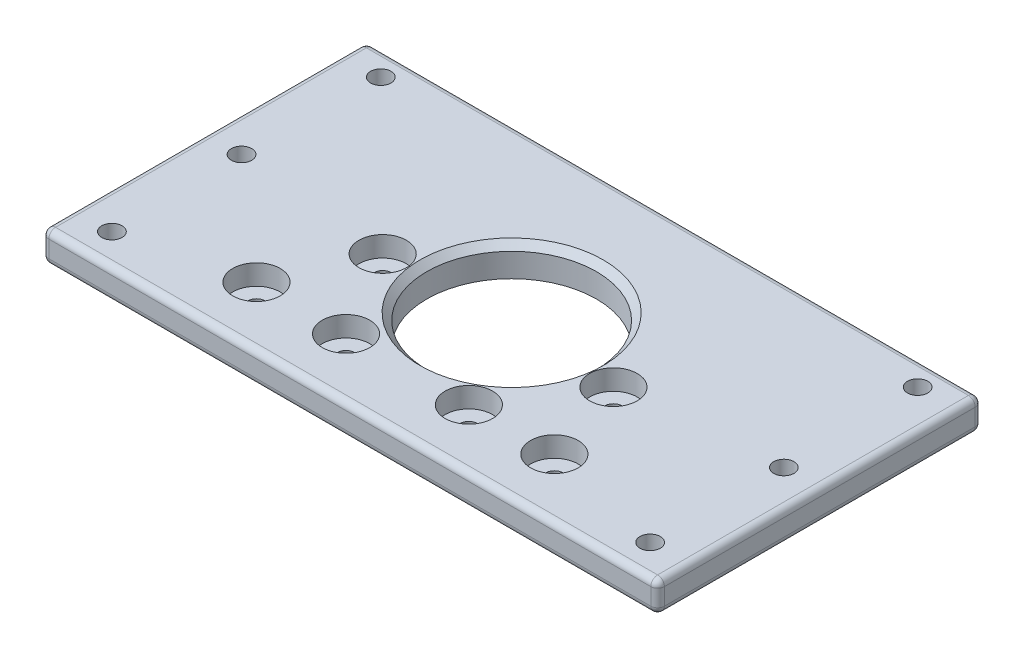
from build123d import *

# Parameters (mm, degrees)
SKETCH1_W           = 90.71
SKETCH1_H           = 47.8
SKETCH1_R           = 1.5
SKETCH1_R_2         = 1.25
SKETCH1_R_3         = 12.5
BOSS_EXTRUDE1_DEPTH = 4.5
SKETCH2_R           = 3.5
CUT_EXTRUDE1_DEPTH  = 3
CHAMFER1_SIZE       = 1
FILLET1_R           = 1


with BuildPart() as part:
    # Sketch1 → Boss-Extrude1 (new body)
    with BuildSketch(Plane(origin=(0, 0, 0), x_dir=(1, 0, 0), z_dir=(0, 1, 0))):
        with Locations((45.355, 23.9)):
            Rectangle(SKETCH1_W, SKETCH1_H)
        with Locations(Location((85.01, 4.6, 0), (0, 0, 270))):
            Circle(SKETCH1_R, mode=Mode.SUBTRACT)
        with Locations(Location((85.31, 24, 0), (0, 0, 270))):
            Circle(SKETCH1_R, mode=Mode.SUBTRACT)
        with Locations(Location((84.91, 44.12, 0), (0, 0, 270))):
            Circle(SKETCH1_R, mode=Mode.SUBTRACT)
        with Locations(Location((5.8, 44.12, 0), (0, 0, 270))):
            Circle(SKETCH1_R, mode=Mode.SUBTRACT)
        with Locations(Location((5.4, 24, 0), (0, 0, 270))):
            Circle(SKETCH1_R, mode=Mode.SUBTRACT)
        with Locations(Location((5.7, 4.6, 0), (0, 0, 270))):
            Circle(SKETCH1_R, mode=Mode.SUBTRACT)
        with Locations(Location((28.5, 21.7, 0), (0, 0, 270))):
            Circle(SKETCH1_R_2, mode=Mode.SUBTRACT)
        with Locations(Location((22.8, 8.8, 0), (0, 0, 270))):
            Circle(SKETCH1_R_2, mode=Mode.SUBTRACT)
        with Locations(Location((36, 8.8, 0), (0, 0, 270))):
            Circle(SKETCH1_R_2, mode=Mode.SUBTRACT)
        with Locations(Location((54.1, 8.8, 0), (0, 0, 270))):
            Circle(SKETCH1_R_2, mode=Mode.SUBTRACT)
        with Locations(Location((66.7, 8.8, 0), (0, 0, 270))):
            Circle(SKETCH1_R_2, mode=Mode.SUBTRACT)
        with Locations(Location((62.5, 21.7, 0), (0, 0, 270))):
            Circle(SKETCH1_R_2, mode=Mode.SUBTRACT)
        with Locations(Location((45.5, 23.7, 0), (0, 0, 270))):
            Circle(SKETCH1_R_3, mode=Mode.SUBTRACT)
    extrude(amount=BOSS_EXTRUDE1_DEPTH)

    # Sketch2 → Cut-Extrude1 (cut)
    with BuildSketch(Plane(origin=(0, 4.5, 0), x_dir=(1, 0, 0), z_dir=(0, 1, 0))):
        with Locations(Location((28.5, 21.7, 0), (0, 0, 270))):
            Circle(SKETCH2_R)
        with Locations(Location((22.8, 8.8, 0), (0, 0, 270))):
            Circle(SKETCH2_R)
        with Locations(Location((36, 8.8, 0), (0, 0, 270))):
            Circle(SKETCH2_R)
        with Locations(Location((54.1, 8.8, 0), (0, 0, 270))):
            Circle(SKETCH2_R)
        with Locations(Location((66.7, 8.8, 0), (0, 0, 270))):
            Circle(SKETCH2_R)
        with Locations(Location((62.5, 21.7, 0), (0, 0, 270))):
            Circle(SKETCH2_R)
    extrude(amount=-CUT_EXTRUDE1_DEPTH, mode=Mode.SUBTRACT)

    # Chamfer1
    chamfer1_edges = [part.edges().sort_by_distance(p)[0] for p in [
        (45.5, 4.5, -36.2),
    ]]
    chamfer(chamfer1_edges, length=CHAMFER1_SIZE)

    # Fillet1
    fillet1_edges = [part.edges().sort_by_distance(p)[0] for p in [
        (90.71, 4.5, -23.9),
        (45.355, 4.5, -47.8),
        (0, 4.5, -23.9),
        (45.355, 0, -47.8),
        (90.71, 0, -23.9),
        (45.355, 0, 0),
        (0, 0, -23.9),
        (0, 2.25, -47.8),
        (90.71, 2.25, -47.8),
        (90.71, 2.25, 0),
        (0, 2.25, 0),
        (45.355, 4.5, 0),
    ]]
    fillet(fillet1_edges, radius=FILLET1_R)


solid = part.part
